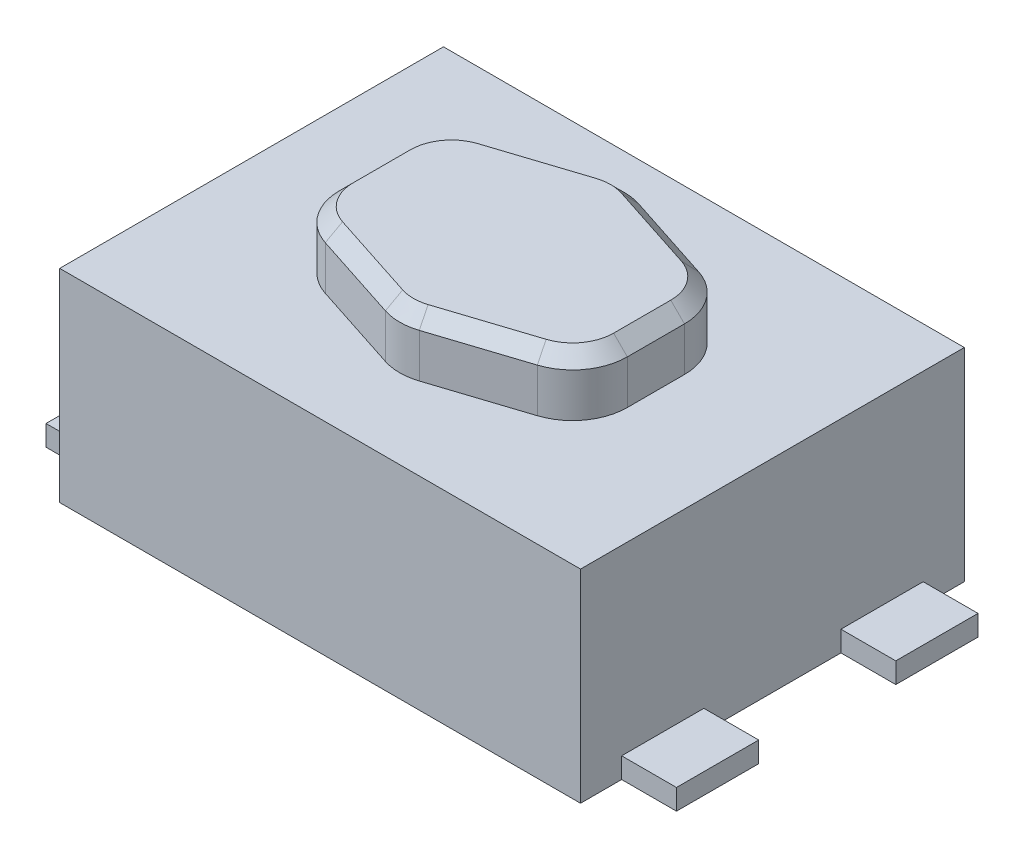
from build123d import *

# Parameters (mm, degrees)
ESQUISSE2_W        = 3.8
ESQUISSE2_H        = 2.8
BOSS_EXTRU_1_DEPTH = 1.48
BOSS_EXTRU_2_DEPTH = 1.9
CHANFREIN1_SIZE    = 0.1
ESQUISSE4_W        = 0.4
ESQUISSE4_H        = 0.6
BOSS_EXTRU_3_DEPTH = 0.15


with BuildPart() as part:
    # Esquisse2 → Boss.-Extru.1 (new body)
    with BuildSketch(Plane(origin=(0, 0, 0), x_dir=(1, 0, 0), z_dir=(0, 1, 0))):
        Rectangle(ESQUISSE2_W, ESQUISSE2_H)
    extrude(amount=BOSS_EXTRU_1_DEPTH)

    # Esquisse3 → Boss.-Extru.2 (add)
    with BuildSketch(Plane(origin=(0, 0, 0), x_dir=(1, 0, 0), z_dir=(0, 1, 0))):
        with BuildLine():
            Line((0.123606798, 0.8), (0.773606798, 0.588802197))
            ThreePointArc((0.773606798, 0.588802197), (0.973606798, 0.443493692), (1.05, 0.208379591))
            Line((1.05, 0.208379591), (1.05, -0.208379591))
            ThreePointArc((1.05, -0.208379591), (0.973606798, -0.443493692), (0.773606798, -0.588802197))
            Line((0.773606798, -0.588802197), (0.123606798, -0.8))
            ThreePointArc((0.123606798, -0.8), (0, -0.819577393), (-0.123606798, -0.8))
            Line((-0.123606798, -0.8), (-0.773606798, -0.588802197))
            ThreePointArc((-0.773606798, -0.588802197), (-0.973606798, -0.443493692), (-1.05, -0.208379591))
            Line((-1.05, -0.208379591), (-1.05, 0.208379591))
            ThreePointArc((-1.05, 0.208379591), (-0.973606798, 0.443493692), (-0.773606798, 0.588802197))
            Line((-0.773606798, 0.588802197), (-0.123606798, 0.8))
            ThreePointArc((-0.123606798, 0.8), (0, 0.819577393), (0.123606798, 0.8))
        make_face()
    extrude(amount=BOSS_EXTRU_2_DEPTH)

    # Chanfrein1
    chanfrein1_edges = [part.edges().sort_by_distance(p)[0] for p in [
        (0, 1.9, -0.819577393),
        (-0.448606798, 1.9, -0.694401099),
        (-0.973606798, 1.9, -0.443493692),
        (-1.05, 1.9, 0),
        (-0.973606798, 1.9, 0.443493692),
        (-0.448606798, 1.9, 0.694401099),
        (0, 1.9, 0.819577393),
        (0.448606798, 1.9, 0.694401099),
        (0.973606798, 1.9, 0.443493692),
        (1.05, 1.9, 0),
        (0.973606798, 1.9, -0.443493692),
        (0.448606798, 1.9, -0.694401099),
    ]]
    chamfer(chanfrein1_edges, length=CHANFREIN1_SIZE)

    # Esquisse4 → Boss.-Extru.3 (add)
    with BuildSketch(Plane(origin=(0, 0, 0), x_dir=(1, 0, 0), z_dir=(0, 1, 0))):
        with Locations((-2.1, 0.8)):
            Rectangle(ESQUISSE4_W, ESQUISSE4_H)
        with Locations((-2.1, -0.8)):
            Rectangle(ESQUISSE4_W, ESQUISSE4_H)
        with Locations((2.1, -0.8)):
            Rectangle(ESQUISSE4_W, ESQUISSE4_H)
        with Locations((2.1, 0.8)):
            Rectangle(ESQUISSE4_W, ESQUISSE4_H)
    extrude(amount=BOSS_EXTRU_3_DEPTH)


solid = part.part
